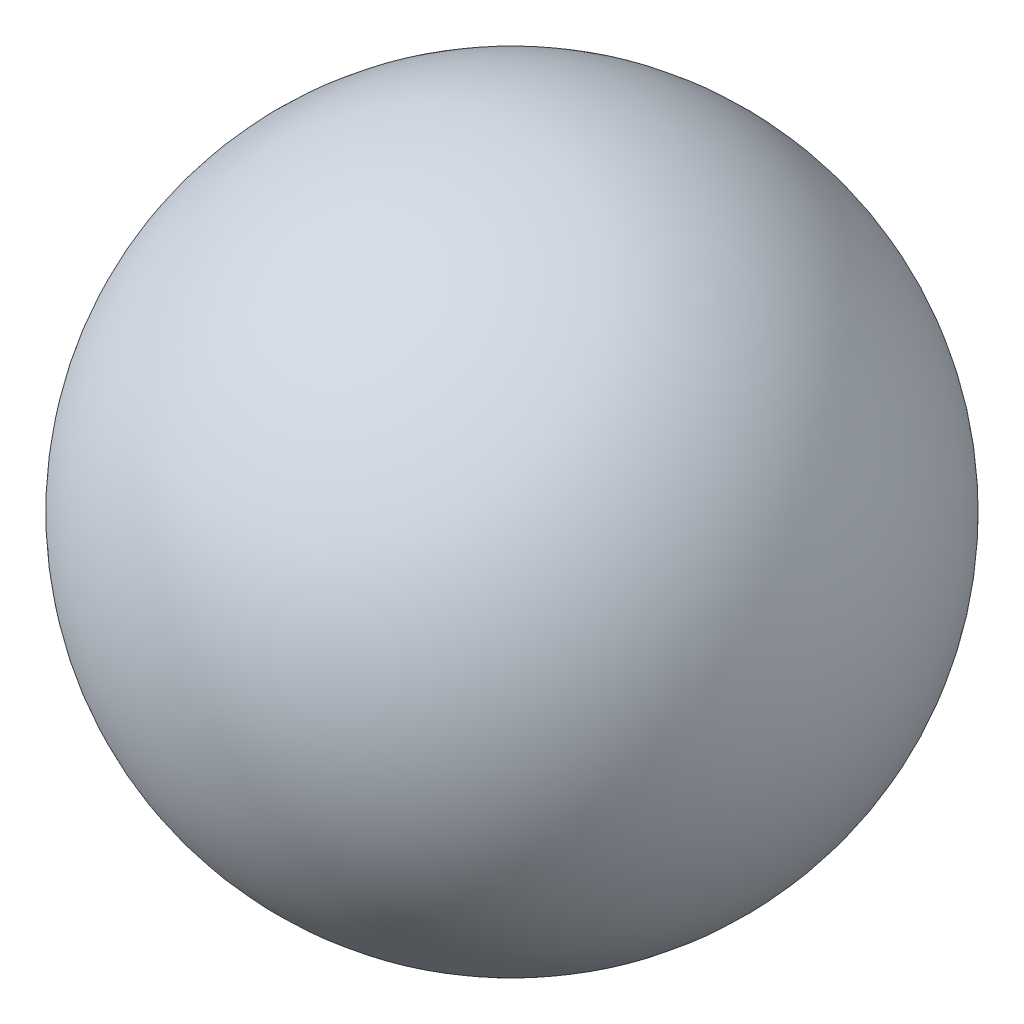
from build123d import *


with BuildPart() as part:
    # 草图1 → 旋转3 (revolve)
    with BuildSketch(Plane.XY):
        with BuildLine():
            Line((0, 0), (0, 8.5))
            ThreePointArc((0, 8.5), (8.5, 0), (0, -8.5))
            Line((0, -8.5), (0, 0))
        make_face()
    revolve(axis=Axis((0, 0, 0), (0, 1, 0)))


solid = part.part
